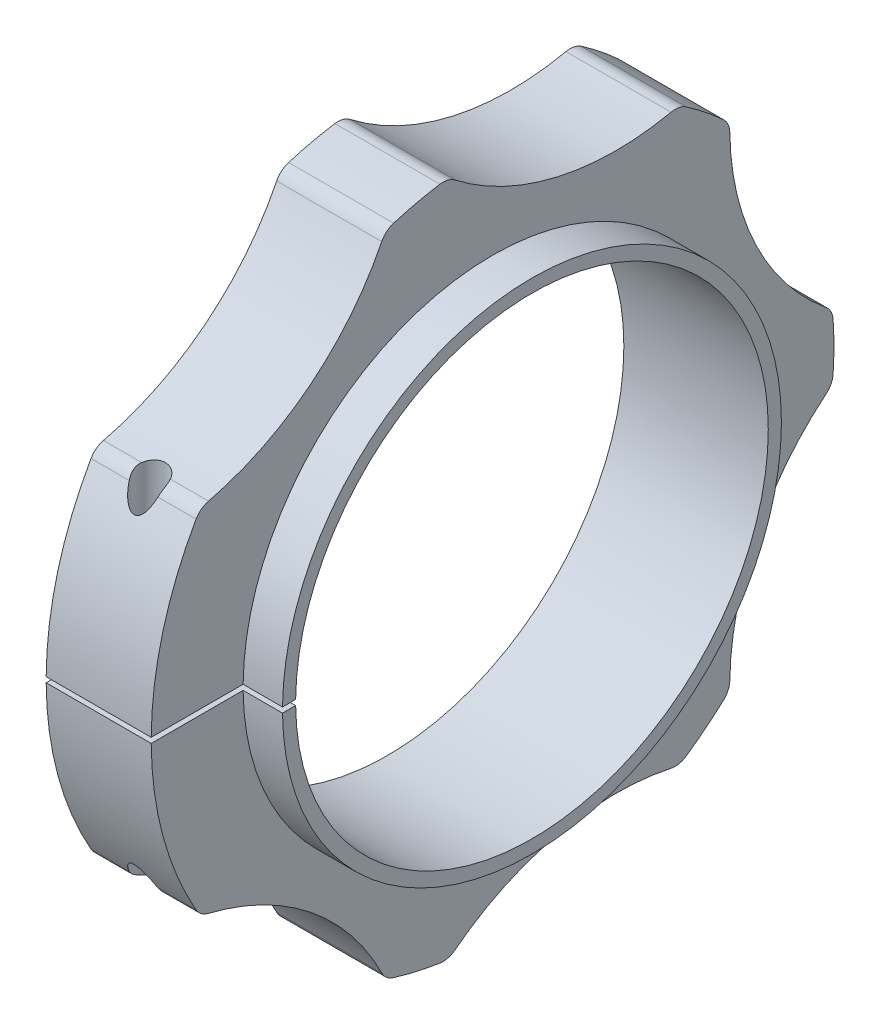
from build123d import *

# Parameters (mm, degrees)
CROQUIS1_R              = 18
SALIENTE_EXTRUIR1_DEPTH = 8
CROQUIS2_R              = 19
CROQUIS2_R_2            = 18
SALIENTE_EXTRUIR2_DEPTH = 3
CROQUIS3_W              = 33
CROQUIS3_H              = 0.4
CORTAR_EXTRUIR2_DEPTH   = 16.5
REDONDEO1_R             = 1.5
CROQUIS4_R              = 1.190625
CORTAR_EXTRUIR3_DEPTH   = 16.5


with BuildPart() as part:
    # Croquis1 → Saliente-Extruir1 (new body)
    with BuildSketch(Plane(origin=(0, 0, 0), x_dir=(0, 0, -1), z_dir=(1, 0, 0))):
        with BuildLine():
            ThreePointArc((-22.245034297, 13.459511474), (-26, 0), (-22.245034297, -13.459511474))
            ThreePointArc((-22.245034297, -13.459511474), (-13.874638854, -17.398246822), (-8.172067613, -24.682327908))
            ThreePointArc((-8.172067613, -24.682327908), (-5.785544283, -25.348125717), (-3.346482217, -25.783736284))
            ThreePointArc((-3.346482217, -25.783736284), (4.951801275, -21.695258927), (14.202220202, -21.778359473))
            ThreePointArc((14.202220202, -21.778359473), (16.210734848, -20.327618544), (18.072039228, -18.69228178))
            ThreePointArc((18.072039228, -18.69228178), (20.049434046, -9.655298558), (25.881946532, -2.474842158))
            ThreePointArc((25.881946532, -2.474842158), (26, 0), (25.881946532, 2.474842158))
            ThreePointArc((25.881946532, 2.474842158), (20.049434046, 9.655298558), (18.072039228, 18.69228178))
            ThreePointArc((18.072039228, 18.69228178), (16.210734848, 20.327618544), (14.202220202, 21.778359473))
            ThreePointArc((14.202220202, 21.778359473), (4.951801275, 21.695258927), (-3.346482217, 25.783736284))
            ThreePointArc((-3.346482217, 25.783736284), (-5.785544283, 25.348125717), (-8.172067613, 24.682327908))
            ThreePointArc((-8.172067613, 24.682327908), (-13.874638854, 17.398246822), (-22.245034297, 13.459511474))
        make_face()
        Circle(CROQUIS1_R, mode=Mode.SUBTRACT)
    extrude(amount=SALIENTE_EXTRUIR1_DEPTH)

    # Croquis2 → Saliente-Extruir2 (add)
    with BuildSketch(Plane(origin=(8, 0, 0), x_dir=(0, 0, -1), z_dir=(1, 0, 0))):
        Circle(CROQUIS2_R)
        Circle(CROQUIS2_R_2, mode=Mode.SUBTRACT)
    extrude(amount=SALIENTE_EXTRUIR2_DEPTH)

    # Croquis3 → Cortar-Extruir2 (cut, symmetric)
    with BuildSketch(Plane(origin=(0, 0, 0), x_dir=(0, 0, -1), z_dir=(1, 0, 0))):
        with Locations((-16.5, 0)):
            Rectangle(CROQUIS3_W, CROQUIS3_H)
    extrude(amount=CORTAR_EXTRUIR2_DEPTH, both=True, mode=Mode.SUBTRACT)

    # Redondeo1
    redondeo1_edges = [part.edges().sort_by_distance(p)[0] for p in [
        (4, 25.783736284, 3.346482217),
        (4, 21.778359473, -14.202220202),
        (4, 18.69228178, -18.072039228),
        (4, 2.474842158, -25.881946532),
        (4, -2.474842158, -25.881946532),
        (4, -18.69228178, -18.072039228),
        (4, -21.778359473, -14.202220202),
        (4, -25.783736284, 3.346482217),
        (4, -24.682327908, 8.172067613),
        (4, -13.459511474, 22.245034297),
        (4, 13.459511474, 22.245034297),
        (4, 24.682327908, 8.172067613),
    ]]
    fillet(redondeo1_edges, radius=REDONDEO1_R)

    # Croquis4 → Cortar-Extruir3 (cut, symmetric)
    with BuildSketch(Plane.XZ.offset(-0.2)):
        with Locations(Location((4, 22.109052571, 0), (0, 0, 270))):
            Circle(CROQUIS4_R)
    extrude(amount=CORTAR_EXTRUIR3_DEPTH, both=True, mode=Mode.SUBTRACT)


solid = part.part
